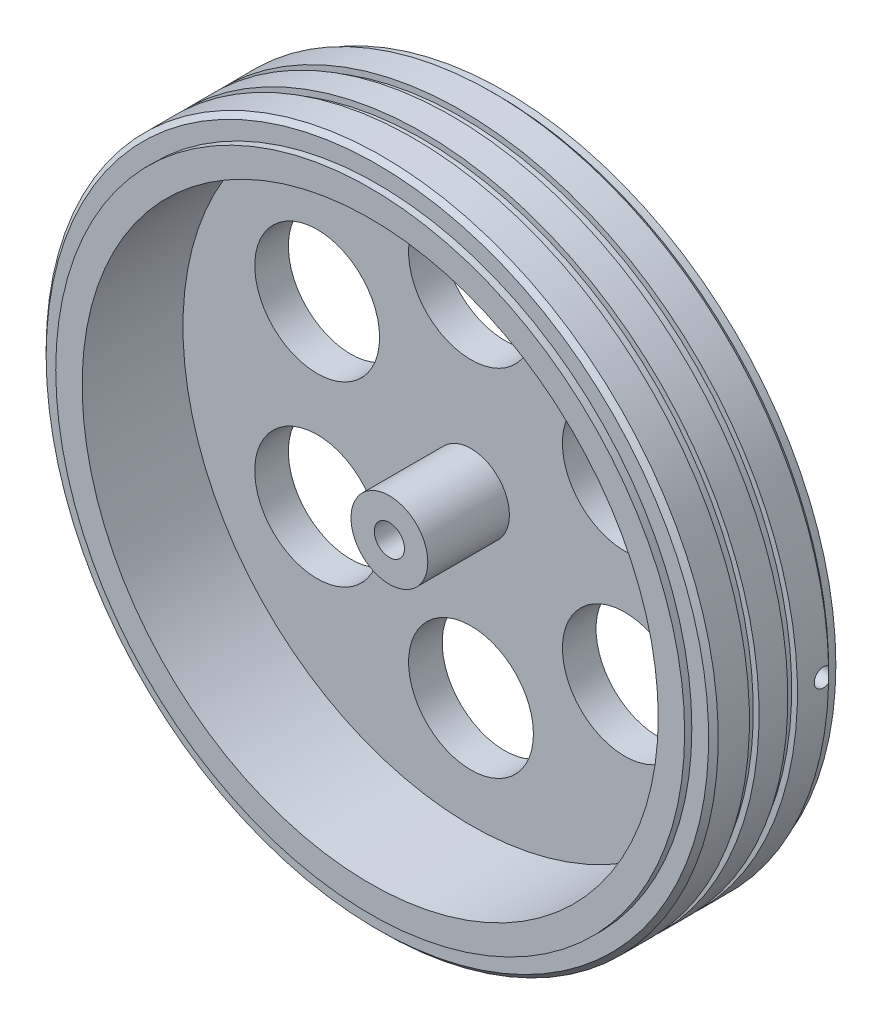
from build123d import *

# Parameters (mm, degrees)
SKETCH1_R              = 64
SKETCH1_R_2            = 60
RIM_DEPTH              = 28
SKETCH2_R              = 65.5
SKETCH2_R_2            = 63
INNER_BEAD_LIP_DEPTH   = 1.5
SKETCH3_R              = 65.5
SKETCH3_R_2            = 63
OUTER_BEAD_LIP_DEPTH   = 1.5
SKETCH4_R              = 61
WEB_DEPTH              = 7
SKETCH5_R              = 8
HUB_BOSS_DEPTH         = 24
SKETCH6_R              = 13
LIGHTENING_HOLES_DEPTH = 9
SKETCH7_R              = 3.15
ROUND_BORE_6MM_DEPTH   = 30
SKETCH9_R              = 69
SKETCH9_R_2            = 64
BED_RING_DEPTH         = 1.5
SKETCH10_R             = 1.3
GRUB_SCREW_M3_DEPTH    = 9
SKETCH11_R             = 1.9
GRUB_KEY_ACCESS_DEPTH  = 62.5


with BuildPart() as part:
    # Sketch1 → Rim (new body)
    with BuildSketch(Plane.XY):
        Circle(SKETCH1_R)
        Circle(SKETCH1_R_2, mode=Mode.SUBTRACT)
    extrude(amount=RIM_DEPTH)

    # Sketch2 → Inner_bead_lip (add)
    with BuildSketch(Plane.XY):
        Circle(SKETCH2_R)
        Circle(SKETCH2_R_2, mode=Mode.SUBTRACT)
    extrude(amount=INNER_BEAD_LIP_DEPTH)

    # Sketch3 → Outer_bead_lip (add)
    with BuildSketch(Plane.XY.offset(26.5)):
        Circle(SKETCH3_R)
        Circle(SKETCH3_R_2, mode=Mode.SUBTRACT)
    extrude(amount=OUTER_BEAD_LIP_DEPTH)

    # Sketch4 → Web (add)
    with BuildSketch(Plane.XY):
        Circle(SKETCH4_R)
    extrude(amount=WEB_DEPTH)

    # Sketch5 → Hub_boss (add)
    with BuildSketch(Plane.XY):
        Circle(SKETCH5_R)
    extrude(amount=HUB_BOSS_DEPTH)

    # Sketch6 → Lightening_holes (cut)
    with BuildSketch(Plane.XY.offset(-1)):
        with Locations((32.04293994, 18.5)):
            Circle(SKETCH6_R)
        with Locations((0, 37)):
            Circle(SKETCH6_R)
        with Locations((-32.04293994, 18.5)):
            Circle(SKETCH6_R)
        with Locations((-32.04293994, -18.5)):
            Circle(SKETCH6_R)
        with Locations((0, -37)):
            Circle(SKETCH6_R)
        with Locations((32.04293994, -18.5)):
            Circle(SKETCH6_R)
    extrude(amount=LIGHTENING_HOLES_DEPTH, mode=Mode.SUBTRACT)

    # Sketch7 → Round_bore_6mm (cut)
    with BuildSketch(Plane.XY.offset(-1)):
        Circle(SKETCH7_R)
    extrude(amount=ROUND_BORE_6MM_DEPTH, mode=Mode.SUBTRACT)

    # Sketch8 → Tyre (revolve)
    with BuildSketch(Plane(origin=(0, 0, 0), x_dir=(0, 0, -1), z_dir=(1, 0, 0)), mode=Mode.PRIVATE) as tyre_sk:
        Polygon((-1.5, 64), (-26.5, 64), (-26.5, 69), (-25.5, 70), (-19, 70), (-19, 68.8), (-17, 68.8), (-17, 70), (-11, 70), (-11, 68.8), (-9, 68.8), (-9, 70), (-2.5, 70), (-1.5, 69), align=None)
    revolve(tyre_sk.sketch.rotate(Axis((0, 0, 0), (0, 0, 1)), 90), axis=Axis((0, 0, 0), (0, 0, 1)))

    # Sketch9 → Bed_ring (add)
    with BuildSketch(Plane.XY):
        with Locations(Location((0, 0, 0), (0, 0, 180))):
            Circle(SKETCH9_R)
        Circle(SKETCH9_R_2, mode=Mode.SUBTRACT)
    extrude(amount=BED_RING_DEPTH)

    # Sketch10 → Grub_screw_M3 (cut)
    with BuildSketch(Plane(origin=(0, 0, 0), x_dir=(0, 0, -1), z_dir=(1, 0, 0))):
        with Locations((-3.6, 0)):
            Circle(SKETCH10_R)
    extrude(amount=GRUB_SCREW_M3_DEPTH, mode=Mode.SUBTRACT)

    # Sketch11 → Grub_key_access (cut)
    with BuildSketch(Plane(origin=(8.5, 0, 0), x_dir=(0, 0, -1), z_dir=(1, 0, 0))):
        with Locations(Location((-3.6, 0, 0), (0, 0, 54.623459848))):
            Circle(SKETCH11_R)
    extrude(amount=GRUB_KEY_ACCESS_DEPTH, mode=Mode.SUBTRACT)


solid = part.part
